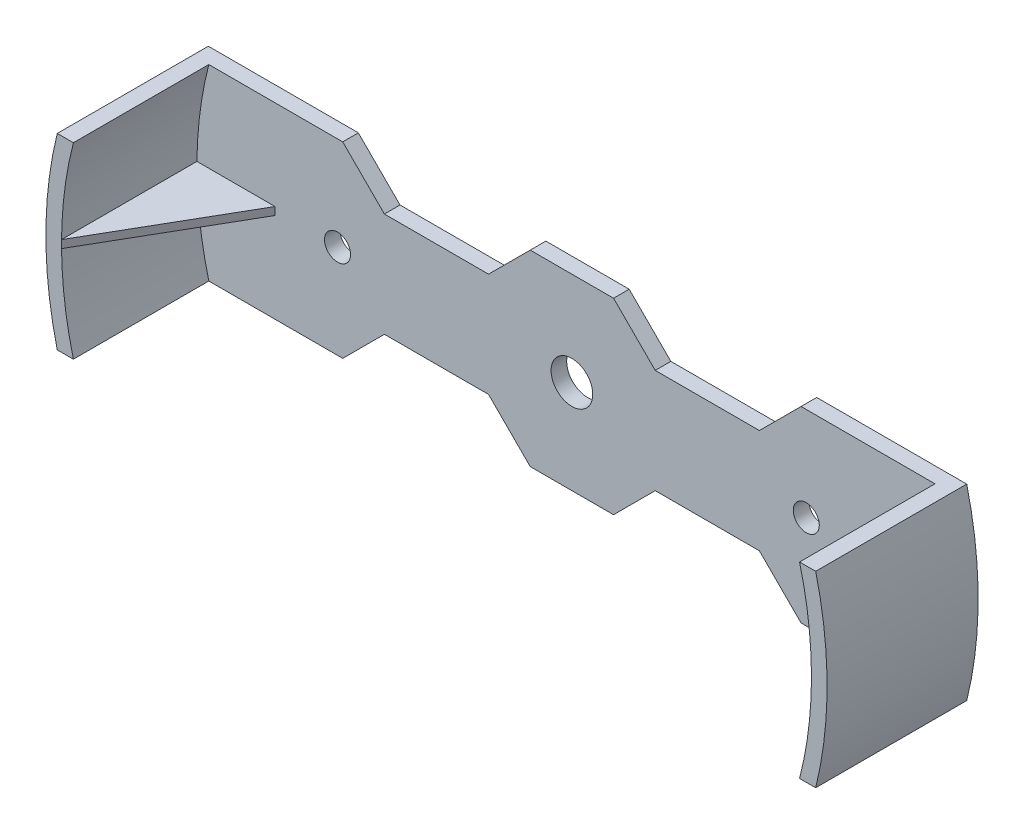
from build123d import *

# Parameters (mm, degrees)
SKETCH1_R           = 2.5
SKETCH1_R_2         = 4
BOSS_EXTRUDE1_DEPTH = 3
BOSS_EXTRUDE2_DEPTH = 26
BOSS_EXTRUDE3_DEPTH = 0.75


with BuildPart() as part:
    # Sketch1 → Boss-Extrude1 (new body)
    with BuildSketch(Plane.XY):
        with BuildLine():
            Line((-44, 18), (-72.807966597, 18))
            ThreePointArc((-72.807966597, 18), (-75, 0), (-72.807966597, -18))
            Line((-72.807966597, -18), (-44, -18))
            Line((-44, -18), (-36, -10))
            Line((-36, -10), (-16, -10))
            Line((-16, -10), (-8, -18))
            Line((-8, -18), (8, -18))
            Line((8, -18), (16, -10))
            Line((16, -10), (36, -10))
            Line((36, -10), (44, -18))
            Line((44, -18), (72.807966597, -18))
            ThreePointArc((72.807966597, -18), (74.449974798, -9.066490645), (75, 0))
            ThreePointArc((75, 0), (74.449974798, 9.066490645), (72.807966597, 18))
            Line((72.807966597, 18), (44, 18))
            Line((44, 18), (36, 10))
            Line((36, 10), (16, 10))
            Line((16, 10), (8, 18))
            Line((8, 18), (-8, 18))
            Line((-8, 18), (-16, 10))
            Line((-16, 10), (-36, 10))
            Line((-36, 10), (-44, 18))
        make_face()
        with Locations((-45, 0)):
            Circle(SKETCH1_R, mode=Mode.SUBTRACT)
        Circle(SKETCH1_R_2, mode=Mode.SUBTRACT)
        with Locations((45, 0)):
            Circle(SKETCH1_R, mode=Mode.SUBTRACT)
    extrude(amount=BOSS_EXTRUDE1_DEPTH)

    # Sketch2 → Boss-Extrude2 (add)
    with BuildSketch(Plane.XY.offset(3)):
        with BuildLine():
            ThreePointArc((69.713700232, 18), (72, 0), (69.713700232, -18))
            Line((69.713700232, -18), (72.807966597, -18))
            ThreePointArc((72.807966597, -18), (75, 0), (72.807966597, 18))
            Line((72.807966597, 18), (69.713700232, 18))
        make_face()
        with BuildLine():
            ThreePointArc((-72.807966597, 18), (-75, 0), (-72.807966597, -18))
            Line((-72.807966597, -18), (-69.713700232, -18))
            ThreePointArc((-69.713700232, -18), (-72, 0), (-69.713700232, 18))
            Line((-69.713700232, 18), (-72.807966597, 18))
        make_face()
    extrude(amount=BOSS_EXTRUDE2_DEPTH)

    # Sketch3 → Boss-Extrude3 (add, symmetric)
    with BuildSketch(Plane(origin=(0, 0, 0), x_dir=(-1, 0, 0), z_dir=(0, -1, 0))):
        Polygon((-72, -3), (-57, -3), (-72, -29), align=None)
        Polygon((72, -29), (72, -3), (57, -3), align=None)
    boss_extrude3 = extrude(amount=BOSS_EXTRUDE3_DEPTH, both=True)

    # Mirror1: Boss-Extrude3 across plane
    add(boss_extrude3.mirror(Plane(origin=(0, 0, 0), x_dir=(0, 0, 1), z_dir=(1, 0, 0))))


solid = part.part
